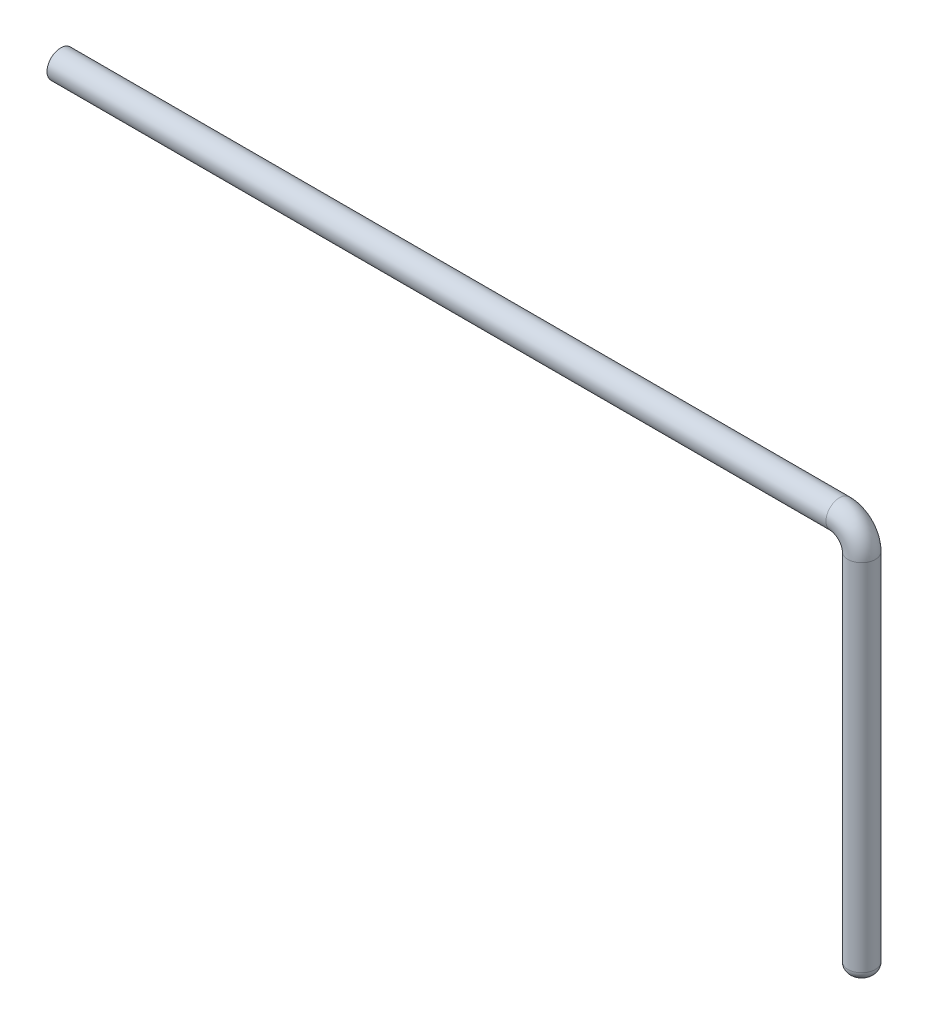
from build123d import *

# Parameters (mm, degrees)
SWEEP_1_PROFILE_R = 0.31
FILLET_1_R        = 0.2


with BuildPart() as part:
    # 扫描1: sweep along a path in 草图1
    with BuildLine(Plane.XY) as sweep_1_path:
        Line((19.401904762, 21.88952381), (37.061904762, 21.88952381))
        ThreePointArc((37.061904762, 21.88952381), (37.415458152, 21.7430772), (37.561904762, 21.38952381))
        Line((37.561904762, 21.38952381), (37.561904762, 13.13952381))
    # 扫描1 profile (on start of the path) → 扫描1 (sweep)
    with BuildSketch(Plane(origin=(19.401904762, 21.88952381, 0), x_dir=(0, 0, 1), z_dir=(1, 0, 0))):
        Circle(SWEEP_1_PROFILE_R)
    sweep(path=sweep_1_path.line)

    # 圆角1
    fillet_1_edges = [part.edges().sort_by_distance(p)[0] for p in [
        (37.561904762, 13.13952381, -0.31),
    ]]
    fillet(fillet_1_edges, radius=FILLET_1_R)


solid = part.part
